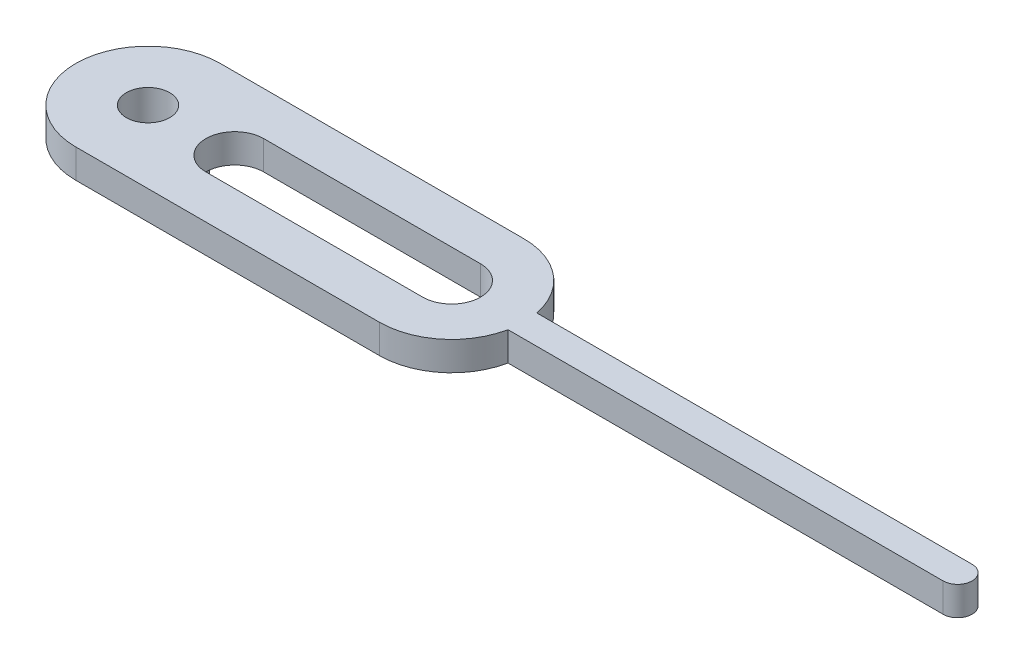
from build123d import *
from build123d.topology import SkipClean

# Parameters (mm, degrees)
SKETCH1_R           = 7.5
BOSS_EXTRUDE1_DEPTH = 10
BOSS_EXTRUDE2_START = 10
SKETCH2_R           = 15
SKETCH2_R_2         = 7.5
BOSS_EXTRUDE2_DEPTH = 10


with BuildPart() as part:
    # Sketch1 → Boss-Extrude1 (new body)
    with BuildSketch(Plane(origin=(0, 0, 0), x_dir=(1, 0, 0), z_dir=(0, 1, 0))):
        with BuildLine():
            Line((14.494897428, 5), (165, 5))
            ThreePointArc((165, 5), (170, 0), (165, -5))
            Line((165, -5), (14.494897428, -5))
            ThreePointArc((14.494897428, -5), (5.811388301, -19.364916731), (-10, -25))
            Line((-10, -25), (-115, -25))
            ThreePointArc((-115, -25), (-140, 0), (-115, 25))
            Line((-115, 25), (-10, 25))
            ThreePointArc((-10, 25), (5.811388301, 19.364916731), (14.494897428, 5))
        make_face()
        with Locations(Location((-115, 0, 0), (0, 0, 270))):
            Circle(SKETCH1_R, mode=Mode.SUBTRACT)
        with BuildLine():
            ThreePointArc((-85, 10), (-95, 0), (-85, -10))
            Line((-85, -10), (-10, -10))
            ThreePointArc((-10, -10), (0, 0), (-10, 10))
            Line((-10, 10), (-85, 10))
        make_face(mode=Mode.SUBTRACT)
    extrude(amount=BOSS_EXTRUDE1_DEPTH)

    # Sketch2 → Boss-Extrude2 (add)
    with SkipClean():  # the faces are left unmerged after this step: merging them gives an invalid solid
        with BuildSketch(Plane.XZ.offset(BOSS_EXTRUDE2_START)):
            with Locations(Location((-115, 0, 0), (0, 0, 90))):
                Circle(SKETCH2_R)
            with Locations(Location((-115, 0, 0), (0, 0, 270))):
                Circle(SKETCH2_R_2, mode=Mode.SUBTRACT)
        extrude(amount=-BOSS_EXTRUDE2_DEPTH)


solid = part.part
